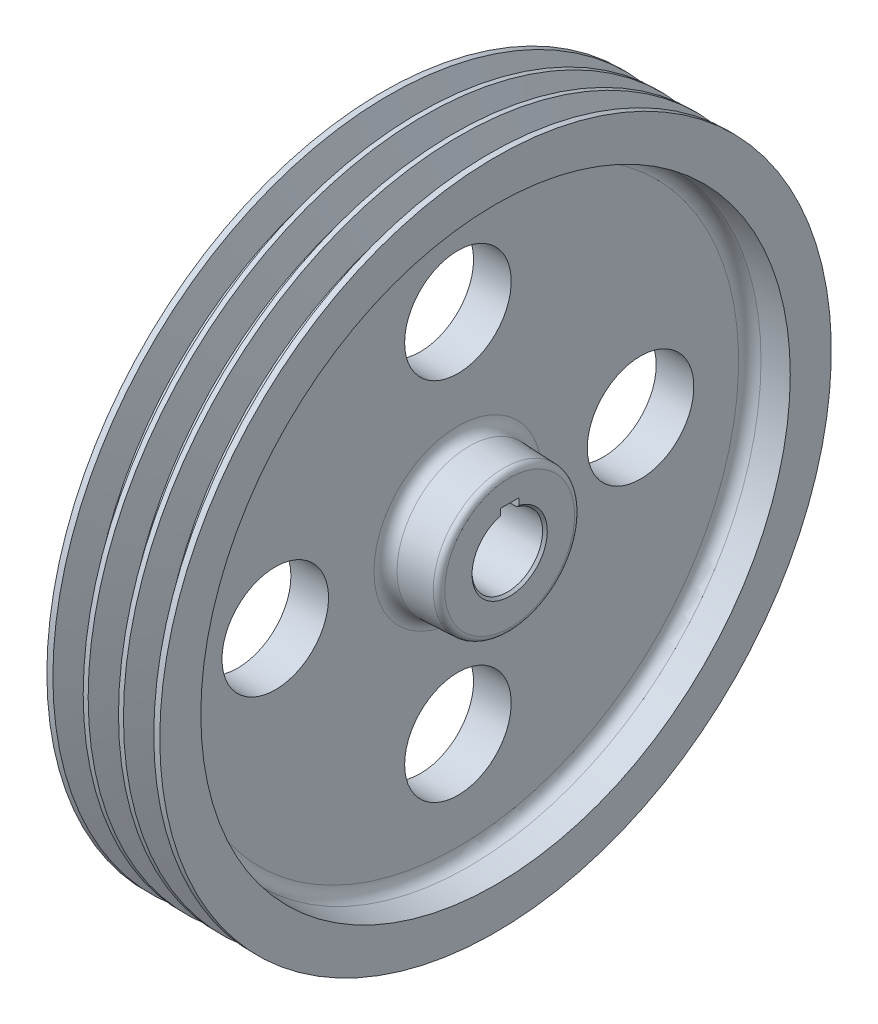
from build123d import *

# Parameters (mm, degrees)
PATTERN_LINEAR_942_COUNT    = 3
PATTERN_LINEAR_942_PITCH    = 15
CHAMFER_1_SIZE              = 1
SKETCH_4_W                  = 8
SKETCH_4_H                  = 3.843167657
CUT_EXTRUDE_1_DEPTH         = 211.606564475
FILLET_1_R                  = 5
FILLET_2_R                  = 2.5
SKETCH_5_R                  = 22.65
CUT_EXTRUDE_2_DEPTH         = 209.976374263
PATTERN_CIRCULAR_1951_COUNT = 4


with BuildPart() as part:
    # 草图1 → 旋转1 (revolve)
    with BuildSketch(Plane.XY, mode=Mode.PRIVATE) as revolve_1_sk:
        Polygon((-6, 15), (-6, 30), (16, 31.924750598), (16, 124.660170629), (0, 125.3), (0, 142.75), (48, 142.75), (48, 125.3), (32, 123.900181384), (32, 30.879765386), (54, 30), (54, 15), align=None)
    revolve(revolve_1_sk.sketch.rotate(Axis((0, 0, 0), (1, 0, 0)), 90), axis=Axis((0, 0, 0), (1, 0, 0)))

    # 草图2 → 切除-旋转1 (revolve, cut)
    with BuildSketch(Plane.XY, mode=Mode.PRIVATE) as cut_revolve_1_sk:
        Polygon((11.504349764, 131.3), (15.446900937, 142.75), (2.553099063, 142.75), (6.495650236, 131.3), align=None)
    cut_revolve_1 = revolve(cut_revolve_1_sk.sketch.rotate(Axis((0, 0, 0), (1, 0, 0)), 90), axis=Axis((0, 0, 0), (1, 0, 0)), mode=Mode.SUBTRACT)

    # Pattern Linear 942: 切除-旋转1 ×3
    with Locations(*[(i * PATTERN_LINEAR_942_PITCH, 0, 0) for i in range(1, PATTERN_LINEAR_942_COUNT)]):
        add(cut_revolve_1, mode=Mode.SUBTRACT)

    # 倒角1
    chamfer_1_edges = [part.edges().sort_by_distance(p)[0] for p in [
        (-6, 0, -15),
        (54, 0, -15),
    ]]
    chamfer(chamfer_1_edges, length=CHAMFER_1_SIZE)

    # 草图4 → 切除-拉伸1 (cut, through all)
    with BuildSketch(Plane.ZY.offset(6)):
        with Locations((0, 16.378416124)):
            Rectangle(SKETCH_4_W, SKETCH_4_H)
    extrude(amount=-CUT_EXTRUDE_1_DEPTH, mode=Mode.SUBTRACT)

    # 圆角1
    fillet_1_edges = [part.edges().sort_by_distance(p)[0] for p in [
        (16, 0, -124.660170629),
        (16, 0, -31.924750598),
        (32, 0, -30.879765386),
        (32, 0, -123.900181384),
    ]]
    fillet(fillet_1_edges, radius=FILLET_1_R)

    # 圆角2
    fillet_2_edges = [part.edges().sort_by_distance(p)[0] for p in [
        (-6, 0, -30),
        (54, 0, -30),
    ]]
    fillet(fillet_2_edges, radius=FILLET_2_R)

    # 草图5 → 切除-拉伸2 (cut, through all)
    with BuildSketch(Plane(origin=(0, 0, 0), x_dir=(0, 0, -1), z_dir=(1, 0, 0))):
        with Locations(Location((0, 77.65, 0), (0, 0, 180))):
            Circle(SKETCH_5_R)
    cut_extrude_2 = extrude(amount=CUT_EXTRUDE_2_DEPTH, mode=Mode.SUBTRACT)

    # Pattern Circular 1951: 切除-拉伸2 ×4 about axis
    pattern_circular_1951_axis = Axis((0, 0, 0), (1, 0, 0))
    for i in range(1, PATTERN_CIRCULAR_1951_COUNT):
        add(cut_extrude_2.rotate(pattern_circular_1951_axis, i * 360 / PATTERN_CIRCULAR_1951_COUNT), mode=Mode.SUBTRACT)


solid = part.part
